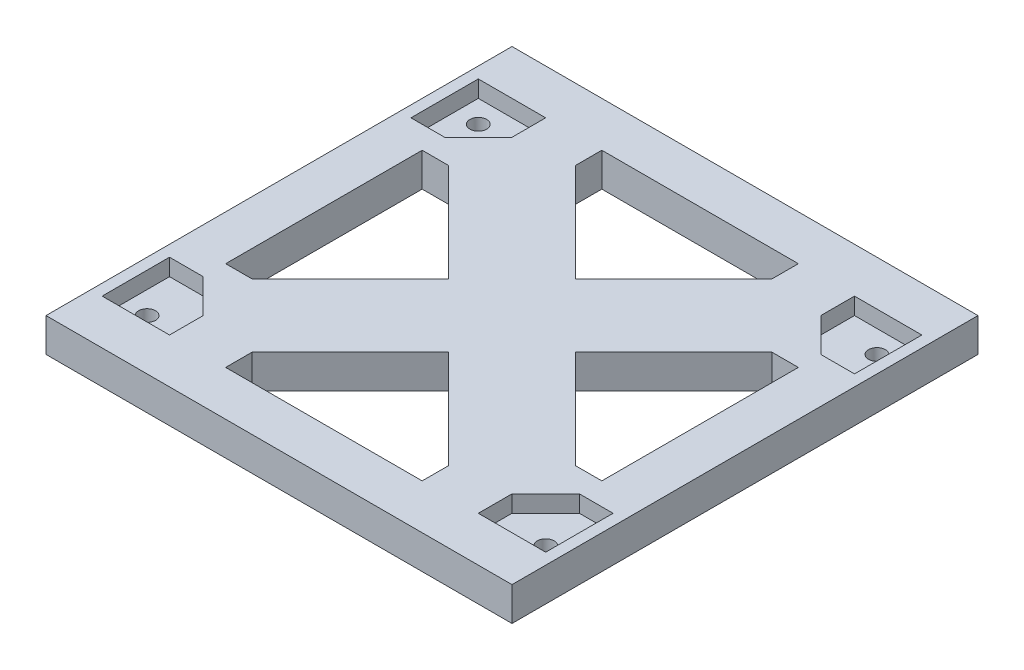
from build123d import *

# Parameters (mm, degrees)
SKETCH1_W                = 83
SKETCH1_H                = 83
BOSS_EXTRUDE1_DEPTH      = 6
SKETCH2_R                = 1.5
CUT_EXTRUDE1_DEPTH       = 118.532974097
CUT_EXTRUDE2_DEPTH       = 118.532974097
CIRPATTERN1_COUNT        = 3
CIRPATTERN1_ANGLE        = 180
CIRPATTERN1_COPY_1_DEPTH = 118.532974097
CIRPATTERN1_COPY_2_DEPTH = 118.532974097
SKETCH4_R                = 1.5
CUT_EXTRUDE4_DEPTH       = 3
MIRROR3_COPY_1_SKETCH_R  = 1.5
MIRROR3_COPY_1_DEPTH     = 3


with BuildPart() as part:
    # Sketch1 → Boss-Extrude1 (new body)
    with BuildSketch(Plane(origin=(0, 0, 0), x_dir=(1, 0, 0), z_dir=(0, 1, 0))):
        with Locations((41.5, 41.5)):
            Rectangle(SKETCH1_W, SKETCH1_H)
    extrude(amount=BOSS_EXTRUDE1_DEPTH)

    # Sketch2 → Cut-Extrude1 (cut, through all)
    with BuildSketch(Plane(origin=(0, 6, 0), x_dir=(1, 0, 0), z_dir=(0, 1, 0))):
        with Locations(Location((6, 71, 0), (0, 0, 270))):
            Circle(SKETCH2_R)
        with Locations(Location((6, 12, 0), (0, 0, 270))):
            Circle(SKETCH2_R)
        with Locations(Location((77, 12, 0), (0, 0, 270))):
            Circle(SKETCH2_R)
        with Locations(Location((77, 71, 0), (0, 0, 270))):
            Circle(SKETCH2_R)
    extrude(amount=-CUT_EXTRUDE1_DEPTH, mode=Mode.SUBTRACT)

    # Sketch3 → Cut-Extrude2 (cut, through all)
    with BuildSketch(Plane(origin=(0, 6, 0), x_dir=(1, 0, 0), z_dir=(0, 1, 0))):
        Polygon((24, 75), (59, 75), (59, 70.313708499), (41.5, 52.813708499), (24, 70.313708499), align=None)
    cut_extrude2 = extrude(amount=-CUT_EXTRUDE2_DEPTH, mode=Mode.SUBTRACT)

    # Mirror1: Cut-Extrude2 across plane
    add(cut_extrude2.mirror(Plane.XY.offset(-41.5)), mode=Mode.SUBTRACT)

    # CirPattern1: Cut-Extrude2 ×3 about axis
    cirpattern1_axis = Axis((41.5, 0, -41.5), (0, 1, 0))
    for i in range(1, CIRPATTERN1_COUNT):
        add(cut_extrude2.rotate(cirpattern1_axis, i * CIRPATTERN1_ANGLE / (CIRPATTERN1_COUNT - 1)), mode=Mode.SUBTRACT)

    # CirPattern1 copy 1 sketch → CirPattern1 copy 1 (cut, through all)
    with BuildSketch(Plane(origin=(0, 6, 0), x_dir=(0, 0, -1), z_dir=(0, 1, 0))):
        Polygon((24, -75), (59, -75), (59, -70.313708499), (41.5, -52.813708499), (24, -70.313708499), align=None)
    extrude(amount=-CIRPATTERN1_COPY_1_DEPTH, mode=Mode.SUBTRACT)

    # CirPattern1 copy 2 sketch → CirPattern1 copy 2 (cut, through all)
    with BuildSketch(Plane(origin=(83, 6, 0), x_dir=(-1, 0, 0), z_dir=(0, 1, 0))):
        Polygon((24, -75), (59, -75), (59, -70.313708499), (41.5, -52.813708499), (24, -70.313708499), align=None)
    extrude(amount=-CIRPATTERN1_COPY_2_DEPTH, mode=Mode.SUBTRACT)

    # Sketch4 → Cut-Extrude4 (cut)
    with BuildSketch(Plane(origin=(0, 6, 0), x_dir=(1, 0, 0), z_dir=(0, 1, 0))):
        Polygon((14, 14), (14, 8), (2, 8), (2, 20), (8, 20), align=None)
        with Locations(Location((6, 12, 0), (0, 0, 270))):
            Circle(SKETCH4_R, mode=Mode.SUBTRACT)
    cut_extrude4 = extrude(amount=-CUT_EXTRUDE4_DEPTH, mode=Mode.SUBTRACT)

    # Mirror2: Cut-Extrude4 across plane
    add(cut_extrude4.mirror(Plane.XY.offset(-41.5)), mode=Mode.SUBTRACT)

    # Mirror3: Cut-Extrude4 across plane
    add(cut_extrude4.mirror(Plane.ZY.offset(-41.5)), mode=Mode.SUBTRACT)

    # Mirror3 copy 1 sketch → Mirror3 copy 1 (cut)
    with BuildSketch(Plane(origin=(83, 6, -83), x_dir=(-1, 0, 0), z_dir=(0, 1, 0))):
        Polygon((14, 14), (14, 8), (2, 8), (2, 20), (8, 20), align=None)
        with Locations(Location((6, 12, 0), (0, 0, 270))):
            Circle(MIRROR3_COPY_1_SKETCH_R, mode=Mode.SUBTRACT)
    extrude(amount=-MIRROR3_COPY_1_DEPTH, mode=Mode.SUBTRACT)


solid = part.part
